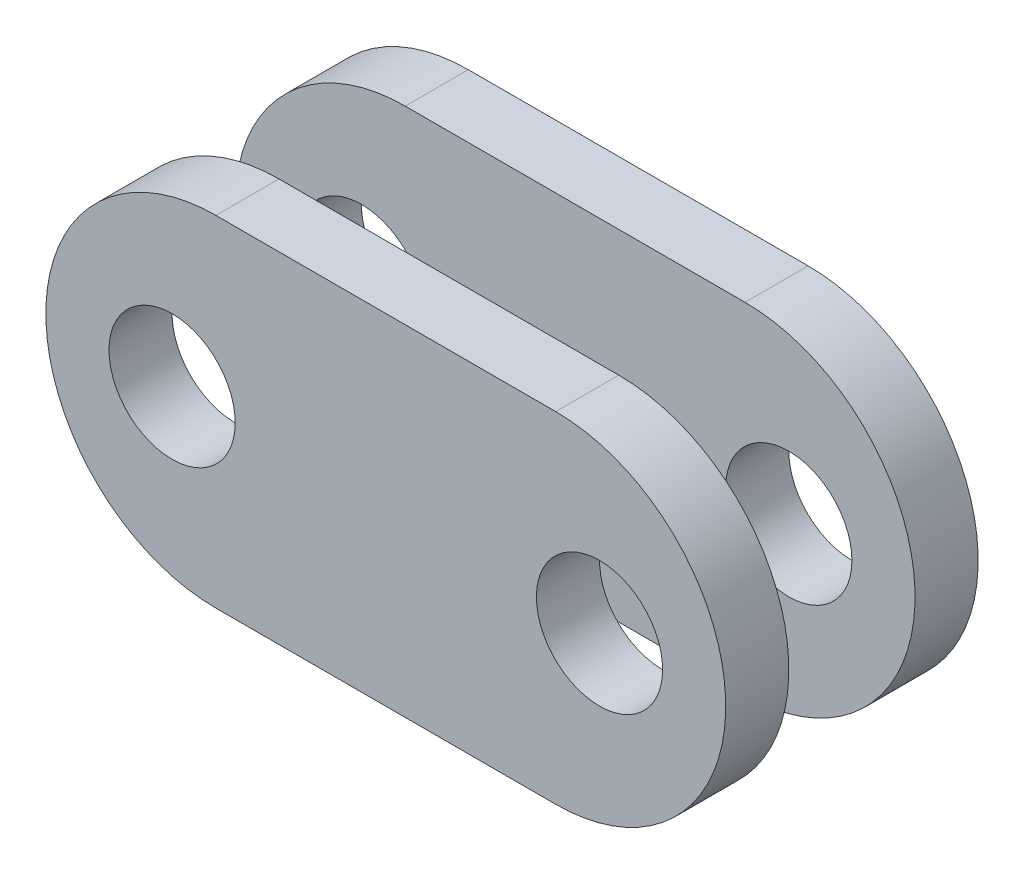
from build123d import *

# Parameters (mm, degrees)
BOSS_EXTRUDE1_DEPTH = 7.62
SKETCH5_W           = 13.683909726
SKETCH5_H           = 1.27
CUT_EXTRUDE5_DEPTH  = 13.318197616
SKETCH3_R           = 1.27
CUT_EXTRUDE6_DEPTH  = 11.797780229
SKETCH6_W           = 13.683909726
SKETCH6_H           = 1.27
CUT_EXTRUDE8_DEPTH  = 12.575668123
SKETCH7_W           = 13.683909726
SKETCH7_H           = 2.54
CUT_EXTRUDE9_DEPTH  = 12.575668123


with BuildPart() as part:
    # Sketch1 → Boss-Extrude1 (new body)
    with BuildSketch(Plane.XY):
        with BuildLine():
            Line((-3.419191134, 3.422763728), (3.419191134, 3.422763728))
            ThreePointArc((3.419191134, 3.422763728), (6.841954863, 0), (3.419191134, -3.422763728))
            Line((3.419191134, -3.422763728), (-3.419191134, -3.422763728))
            ThreePointArc((-3.419191134, -3.422763728), (-6.841954863, 0), (-3.419191134, 3.422763728))
        make_face()
    extrude(amount=BOSS_EXTRUDE1_DEPTH)

    # Sketch5 → Cut-Extrude5 (cut, through all)
    with BuildSketch(Plane(origin=(0, 3.422763728, 0), x_dir=(1, 0, 0), z_dir=(0, 1, 0))):
        with Locations((0, -6.985)):
            Rectangle(SKETCH5_W, SKETCH5_H)
    extrude(amount=-CUT_EXTRUDE5_DEPTH, mode=Mode.SUBTRACT)

    # Sketch3 → Cut-Extrude6 (cut, through all)
    with BuildSketch(Plane.XY.offset(7.62)):
        with Locations((-4.301250903, 0)):
            Circle(SKETCH3_R)
    cut_extrude6 = extrude(amount=-CUT_EXTRUDE6_DEPTH, mode=Mode.SUBTRACT)

    # Mirror2: Cut-Extrude6 across plane
    add(cut_extrude6.mirror(Plane(origin=(0, 0, 0), x_dir=(0, 0, 1), z_dir=(1, 0, 0))), mode=Mode.SUBTRACT)

    # Sketch6 → Cut-Extrude8 (cut, through all)
    with BuildSketch(Plane(origin=(0, 3.422763728, 0), x_dir=(1, 0, 0), z_dir=(0, 1, 0))):
        with Locations((0, -0.635)):
            Rectangle(SKETCH6_W, SKETCH6_H)
    extrude(amount=-CUT_EXTRUDE8_DEPTH, mode=Mode.SUBTRACT)

    # Sketch7 → Cut-Extrude9 (cut, through all)
    with BuildSketch(Plane(origin=(0, 3.422763728, 0), x_dir=(1, 0, 0), z_dir=(0, 1, 0))):
        with Locations((0, -3.81)):
            Rectangle(SKETCH7_W, SKETCH7_H)
    extrude(amount=-CUT_EXTRUDE9_DEPTH, mode=Mode.SUBTRACT)


with BuildPart() as cut_extrude9_piece_1:
    # of the separate pieces the step leaves, piece 1, a body of its own (cut_extrude9_pieces)
    add(part.part.solids().sort_by_distance((3.419191134, 3.422763728, 5.08))[0])


with BuildPart() as cut_extrude9_piece_2:
    # of the separate pieces the step leaves, piece 2, a body of its own (cut_extrude9_pieces)
    add(part.part.solids().sort_by_distance((3.419191134, 3.422763728, 1.27))[0])


solid = Compound([cut_extrude9_piece_1.part, cut_extrude9_piece_2.part])
